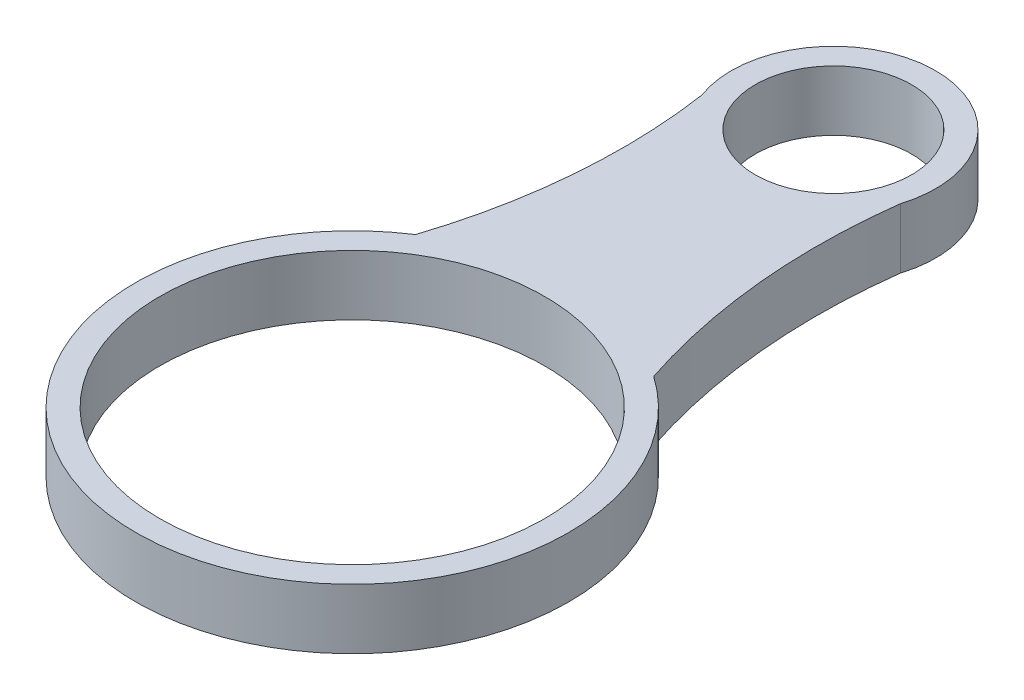
from build123d import *

# Parameters (mm, degrees)
BOSS_EXTRUDE1_DEPTH = 50
SKETCH5_R           = 65
CUT_EXTRUDE3_DEPTH  = 50
SKETCH4_R           = 160
CUT_EXTRUDE4_DEPTH  = 50


with BuildPart() as part:
    # Sketch1 → Boss-Extrude1 (new body)
    with BuildSketch(Plane(origin=(0, 0, 0), x_dir=(1, 0, 0), z_dir=(0, 1, 0))):
        with BuildLine():
            ThreePointArc((-79.615153419, -29.772929752), (-76.142301846, -140.554949646), (-98.232528839, -249.167741256))
            ThreePointArc((-98.232528839, -249.167741256), (-2.78801704, -579.97840693), (102.857311412, -252.28279217))
            ThreePointArc((102.857311412, -252.28279217), (79.272553954, -140.112834924), (81.083403738, -25.504541524))
            ThreePointArc((81.083403738, -25.504541524), (-2.256928059, 84.970031633), (-79.615153419, -29.772929752))
        make_face()
    extrude(amount=BOSS_EXTRUDE1_DEPTH)

    # Sketch5 → Cut-Extrude3 (cut)
    with BuildSketch(Plane(origin=(0, 50, 0), x_dir=(1, 0, 0), z_dir=(0, 1, 0))):
        with Locations(Location((0, 0, 0), (0, 0, 270))):
            Circle(SKETCH5_R)
    extrude(amount=-CUT_EXTRUDE3_DEPTH, mode=Mode.SUBTRACT)

    # Sketch4 → Cut-Extrude4 (cut)
    with BuildSketch(Plane(origin=(0, 50, 0), x_dir=(1, 0, 0), z_dir=(0, 1, 0))):
        with Locations(Location((0, -400, 0), (0, 0, 270))):
            Circle(SKETCH4_R)
    extrude(amount=-CUT_EXTRUDE4_DEPTH, mode=Mode.SUBTRACT)


solid = part.part
